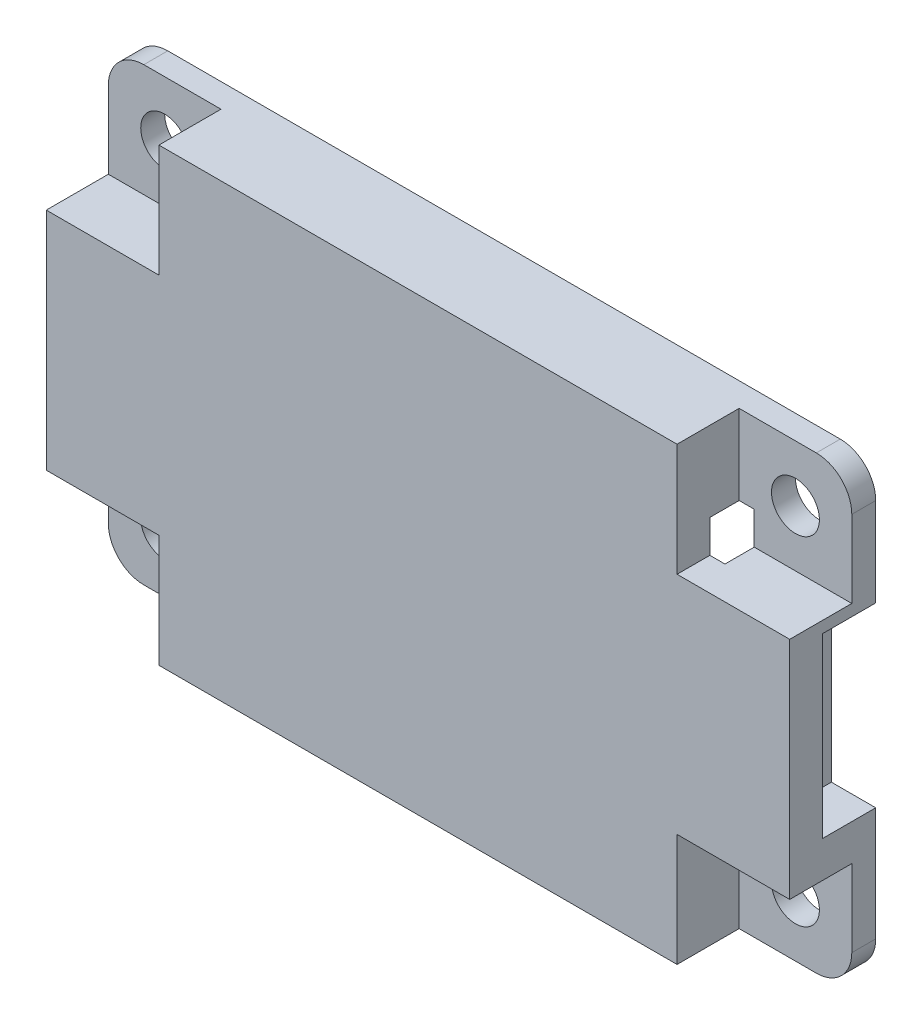
from build123d import *

# Parameters (mm, degrees)
SKETCH1_R           = 1.35
BOSS_EXTRUDE1_DEPTH = 4.85
SKETCH2_W           = 2.5
SKETCH2_H           = 10
SKETCH2_W_2         = 10
SKETCH2_H_2         = 15
CUT_EXTRUDE1_DEPTH  = 3
SKETCH4_W           = 6.35
SKETCH4_H           = 6.35
CUT_EXTRUDE3_DEPTH  = 3.5


with BuildPart() as part:
    # Sketch1 → Boss-Extrude1 (new body)
    with BuildSketch(Plane.XY):
        with BuildLine():
            Line((-2, 0), (-39.91, 0))
            ThreePointArc((-39.91, 0), (-41.324213562, -0.585786438), (-41.91, -2))
            Line((-41.91, -2), (-41.91, -23.4))
            ThreePointArc((-41.91, -23.4), (-41.324213562, -24.814213562), (-39.91, -25.4))
            Line((-39.91, -25.4), (-2, -25.4))
            ThreePointArc((-2, -25.4), (-0.585786438, -24.814213562), (0, -23.4))
            Line((0, -23.4), (0, -2))
            ThreePointArc((0, -2), (-0.585786438, -0.585786438), (-2, 0))
        make_face()
        with Locations(Location((-38.735, -22.225, 0), (0, 0, 180))):
            Circle(SKETCH1_R, mode=Mode.SUBTRACT)
        with Locations(Location((-38.735, -3.175, 0), (0, 0, 180))):
            Circle(SKETCH1_R, mode=Mode.SUBTRACT)
        with Locations(Location((-3.175, -3.175, 0), (0, 0, 180))):
            Circle(SKETCH1_R, mode=Mode.SUBTRACT)
        with Locations(Location((-3.175, -22.225, 0), (0, 0, 180))):
            Circle(SKETCH1_R, mode=Mode.SUBTRACT)
    extrude(amount=BOSS_EXTRUDE1_DEPTH)

    # Sketch2 → Cut-Extrude1 (cut)
    with BuildSketch(Plane(origin=(0, 0, 0), x_dir=(-1, 0, 0), z_dir=(0, 0, -1))):
        with Locations((1.25, -12)):
            Rectangle(SKETCH2_W, SKETCH2_H)
        with Locations((10.5, -12)):
            Rectangle(SKETCH2_W_2, SKETCH2_H_2)
        with Locations((36.86, -12)):
            Rectangle(SKETCH2_W, SKETCH2_H)
    extrude(amount=-CUT_EXTRUDE1_DEPTH, mode=Mode.SUBTRACT)

    # Sketch4 → Cut-Extrude3 (cut)
    with BuildSketch(Plane.XY.offset(4.85)):
        with Locations((-38.735, -3.175)):
            Rectangle(SKETCH4_W, SKETCH4_H)
        with Locations((-38.735, -22.225)):
            Rectangle(SKETCH4_W, SKETCH4_H)
        with Locations((-3.175, -22.225)):
            Rectangle(SKETCH4_W, SKETCH4_H)
        with Locations((-3.175, -3.175)):
            Rectangle(SKETCH4_W, SKETCH4_H)
    extrude(amount=-CUT_EXTRUDE3_DEPTH, mode=Mode.SUBTRACT)


solid = part.part
